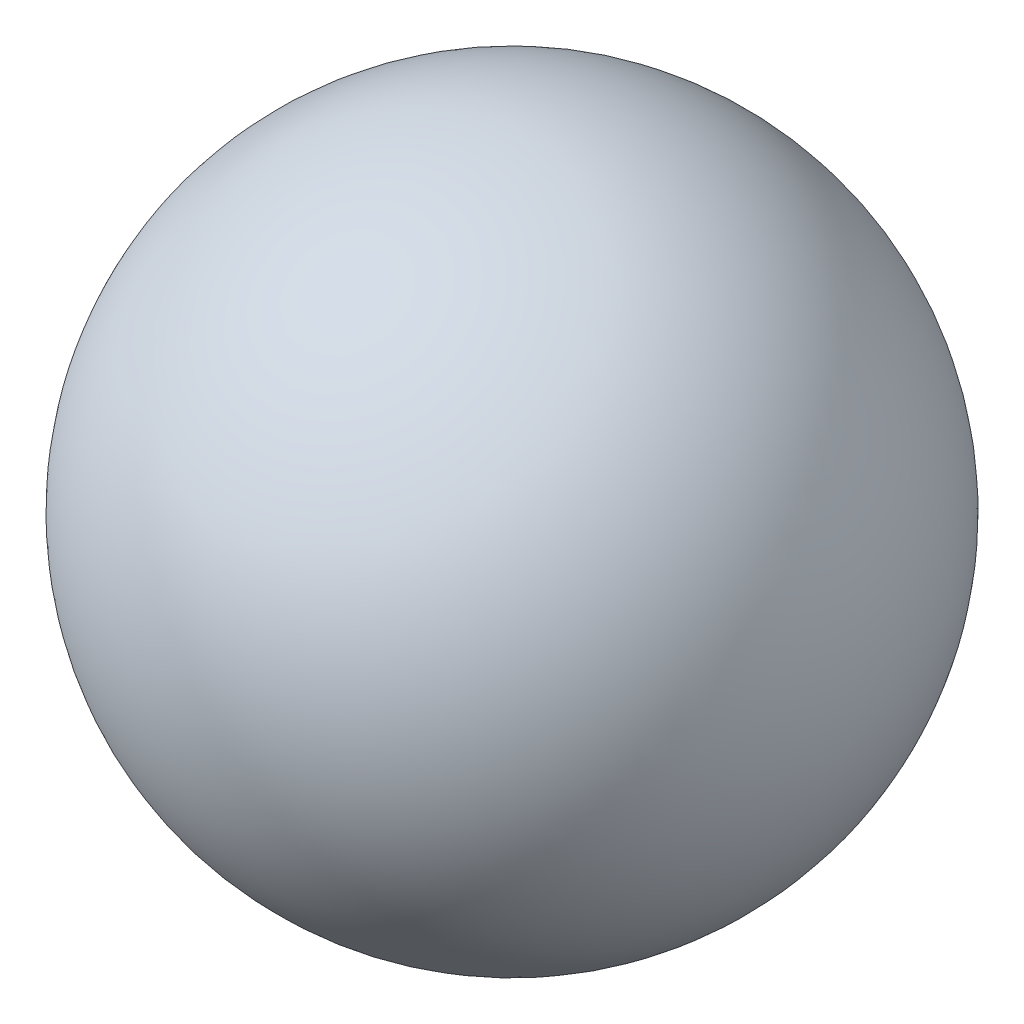
from build123d import *

# Parameters (mm, degrees)
SHELL1_T = 3.175


with BuildPart() as part:
    # Sketch1 → Revolve6 (revolve)
    with BuildSketch(Plane(origin=(0, 0, 0), x_dir=(1, 0, 0), z_dir=(0, 1, 0))):
        with BuildLine():
            Line((-274.32, 0), (274.32, 0))
            ThreePointArc((274.32, 0), (0, 274.32), (-274.32, 0))
        make_face()
    revolve(axis=Axis((0, 0, 0), (1, 0, 0)))

    # Shell1 (no face opened: a closed hollow body)
    add(offset(amount=-SHELL1_T, mode=Mode.PRIVATE), mode=Mode.SUBTRACT)


solid = part.part
